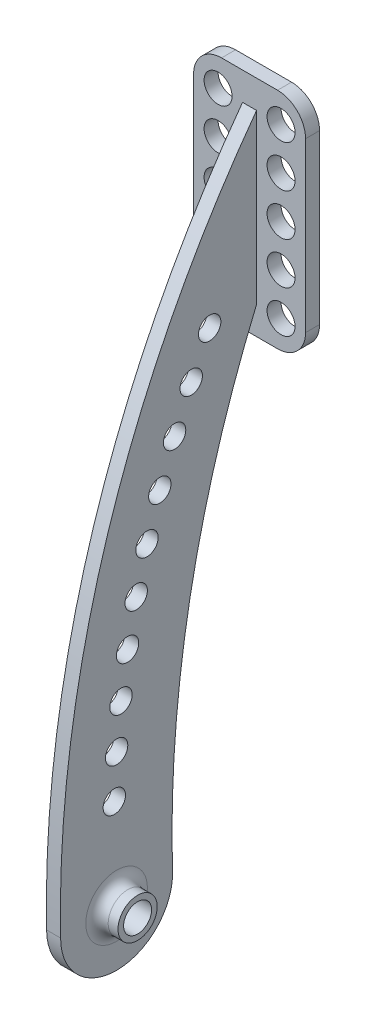
from build123d import *

# Parameters (mm, degrees)
SKETCH1_R                = 5
SKETCH1_R_2              = 4
BOSS_EXTRUDE1_DEPTH      = 5
BOSS_EXTRUDE3_DEPTH      = 7.5
BOSS_EXTRUDE3_DEPTH_BACK = 12.5
SKETCH2_R                = 7
SKETCH2_R_2              = 5
SKETCH3_R                = 5
BOSS_EXTRUDE4_DEPTH      = 5
FILLET1_R                = 4


with BuildPart() as part:
    # Sketch1 → Boss-Extrude1 (new body)
    with BuildSketch(Plane(origin=(0, 0, 0), x_dir=(0, 0, -1), z_dir=(1, 0, 0))):
        with BuildLine():
            Line((50, 221.0514346), (50, 161.0514346))
            ThreePointArc((50, 161.0514346), (26.21791649, 82.161607759), (20, 0))
            ThreePointArc((20, 0), (0, -20), (-20, 0))
            ThreePointArc((-20, 0), (-3.28398519, 116.315677296), (50, 221.0514346))
        make_face()
        Circle(SKETCH1_R, mode=Mode.SUBTRACT)
        with Locations((0, 47.625)):
            Circle(SKETCH1_R_2, mode=Mode.SUBTRACT)
        with Locations((1.573444046, 62.542247529)):
            Circle(SKETCH1_R_2, mode=Mode.SUBTRACT)
        with Locations((3.912796623, 77.358705591)):
            Circle(SKETCH1_R_2, mode=Mode.SUBTRACT)
        with Locations((7.013151247, 92.034801844)):
            Circle(SKETCH1_R_2, mode=Mode.SUBTRACT)
        with Locations((10.86160852, 106.532711232)):
            Circle(SKETCH1_R_2, mode=Mode.SUBTRACT)
        with Locations((15.437856468, 120.817596765)):
            Circle(SKETCH1_R_2, mode=Mode.SUBTRACT)
        with Locations((20.715135496, 134.858619736)):
            Circle(SKETCH1_R_2, mode=Mode.SUBTRACT)
        with Locations((26.661473463, 148.629642385)):
            Circle(SKETCH1_R_2, mode=Mode.SUBTRACT)
        with Locations((33.241055411, 162.109594216)):
            Circle(SKETCH1_R_2, mode=Mode.SUBTRACT)
        with Locations((-0.810748538, 32.646926465)):
            Circle(SKETCH1_R_2, mode=Mode.SUBTRACT)
    extrude(amount=BOSS_EXTRUDE1_DEPTH)

    # Sketch2 → Boss-Extrude3 (add, two sides: drawn at the far end of the back side and taken through both)
    with BuildSketch(Plane(origin=(5, 0, 0), x_dir=(0, 0, -1), z_dir=(1, 0, 0)).offset(-BOSS_EXTRUDE3_DEPTH_BACK)):
        Circle(SKETCH2_R)
        Circle(SKETCH2_R_2, mode=Mode.SUBTRACT)
    extrude(amount=BOSS_EXTRUDE3_DEPTH + BOSS_EXTRUDE3_DEPTH_BACK)

    # Sketch3 → Boss-Extrude4 (add)
    with BuildSketch(Plane(origin=(0, 0, -50), x_dir=(-1, 0, 0), z_dir=(0, 0, -1))):
        with BuildLine():
            Line((-12.5, 151.0514346), (7.5, 151.0514346))
            ThreePointArc((7.5, 151.0514346), (14.571067812, 153.980366789), (17.5, 161.0514346))
            Line((17.5, 161.0514346), (17.5, 221.0514346))
            ThreePointArc((17.5, 221.0514346), (14.571067812, 228.122502412), (7.5, 231.0514346))
            Line((7.5, 231.0514346), (-12.5, 231.0514346))
            ThreePointArc((-12.5, 231.0514346), (-19.571067812, 228.122502412), (-22.5, 221.0514346))
            Line((-22.5, 221.0514346), (-22.5, 161.0514346))
            ThreePointArc((-22.5, 161.0514346), (-19.571067812, 153.980366789), (-12.5, 151.0514346))
        make_face()
        with Locations((-13.75, 221.0514346)):
            Circle(SKETCH3_R, mode=Mode.SUBTRACT)
        with Locations((-13.75, 206.0514346)):
            Circle(SKETCH3_R, mode=Mode.SUBTRACT)
        with Locations((-13.75, 191.0514346)):
            Circle(SKETCH3_R, mode=Mode.SUBTRACT)
        with Locations(Location((-13.75, 161.0514346, 0), (0, 0, 180))):
            Circle(SKETCH3_R, mode=Mode.SUBTRACT)
        with Locations(Location((-13.75, 176.0514346, 0), (0, 0, 180))):
            Circle(SKETCH3_R, mode=Mode.SUBTRACT)
        with Locations((8.75, 161.0514346)):
            Circle(SKETCH3_R, mode=Mode.SUBTRACT)
        with Locations((8.75, 176.0514346)):
            Circle(SKETCH3_R, mode=Mode.SUBTRACT)
        with Locations(Location((8.75, 191.0514346, 0), (0, 0, 180))):
            Circle(SKETCH3_R, mode=Mode.SUBTRACT)
        with Locations(Location((8.75, 206.0514346, 0), (0, 0, 180))):
            Circle(SKETCH3_R, mode=Mode.SUBTRACT)
        with Locations(Location((8.75, 221.0514346, 0), (0, 0, 180))):
            Circle(SKETCH3_R, mode=Mode.SUBTRACT)
    extrude(amount=BOSS_EXTRUDE4_DEPTH)

    # Fillet1
    fillet1_edges = [part.edges().sort_by_distance(p)[0] for p in [
        (5, 0, 7),
        (0, 0, 7),
    ]]
    fillet(fillet1_edges, radius=FILLET1_R)


solid = part.part
